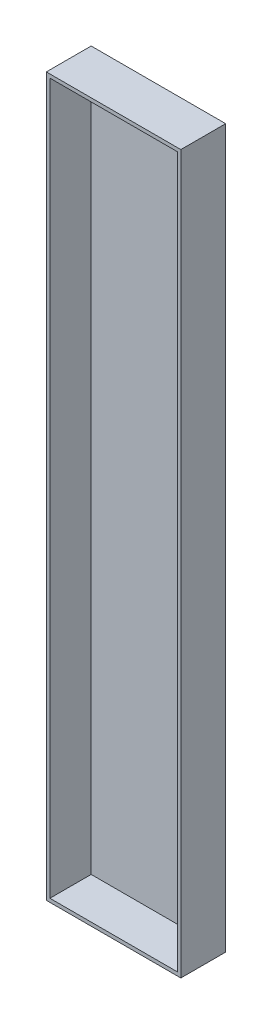
from build123d import *

# Parameters (mm, degrees)
ESQUISSE1_W             = 150
ESQUISSE1_H             = 800
BOSS_EXTRU_1_DEPTH      = 50
ESQUISSE2_W             = 142
ESQUISSE2_H             = 792
ENL_V_MAT_EXTRU_1_DEPTH = 46


with BuildPart() as part:
    # Esquisse1 → Boss.-Extru.1 (new body)
    with BuildSketch(Plane.XY):
        with Locations((75, -400)):
            Rectangle(ESQUISSE1_W, ESQUISSE1_H)
    extrude(amount=BOSS_EXTRU_1_DEPTH)

    # Esquisse2 → Enlèv. mat.-Extru.1 (cut)
    with BuildSketch(Plane.XY.offset(50)):
        with Locations((75, -400)):
            Rectangle(ESQUISSE2_W, ESQUISSE2_H)
    extrude(amount=-ENL_V_MAT_EXTRU_1_DEPTH, mode=Mode.SUBTRACT)


solid = part.part
